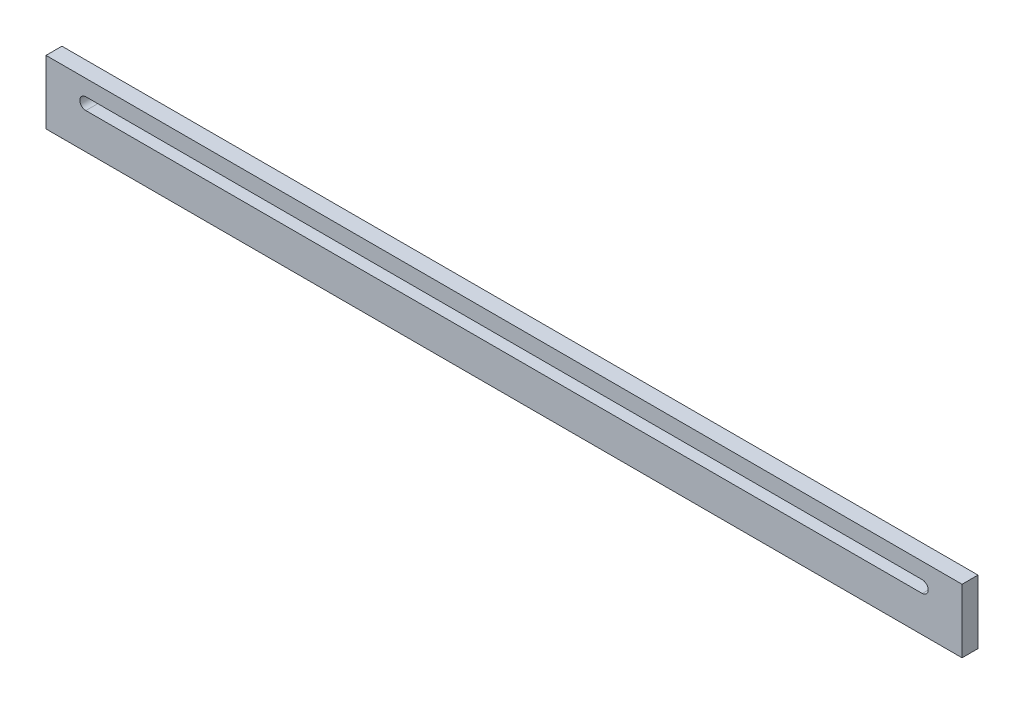
from build123d import *

# Parameters (mm, degrees)
SKETCH_1_W      = 230
SKETCH_1_H      = 16
EXTRUDE_1_DEPTH = 4


with BuildPart() as part:
    # 草图1 → 凸台-拉伸1 (new body)
    with BuildSketch(Plane.XY):
        with Locations((115, -8)):
            Rectangle(SKETCH_1_W, SKETCH_1_H)
        with BuildLine():
            Line((10, -4), (220, -4))
            ThreePointArc((220, -4), (221.5, -5.5), (220, -7))
            Line((220, -7), (10, -7))
            ThreePointArc((10, -7), (8.5, -5.5), (10, -4))
        make_face(mode=Mode.SUBTRACT)
    extrude(amount=EXTRUDE_1_DEPTH)


solid = part.part
